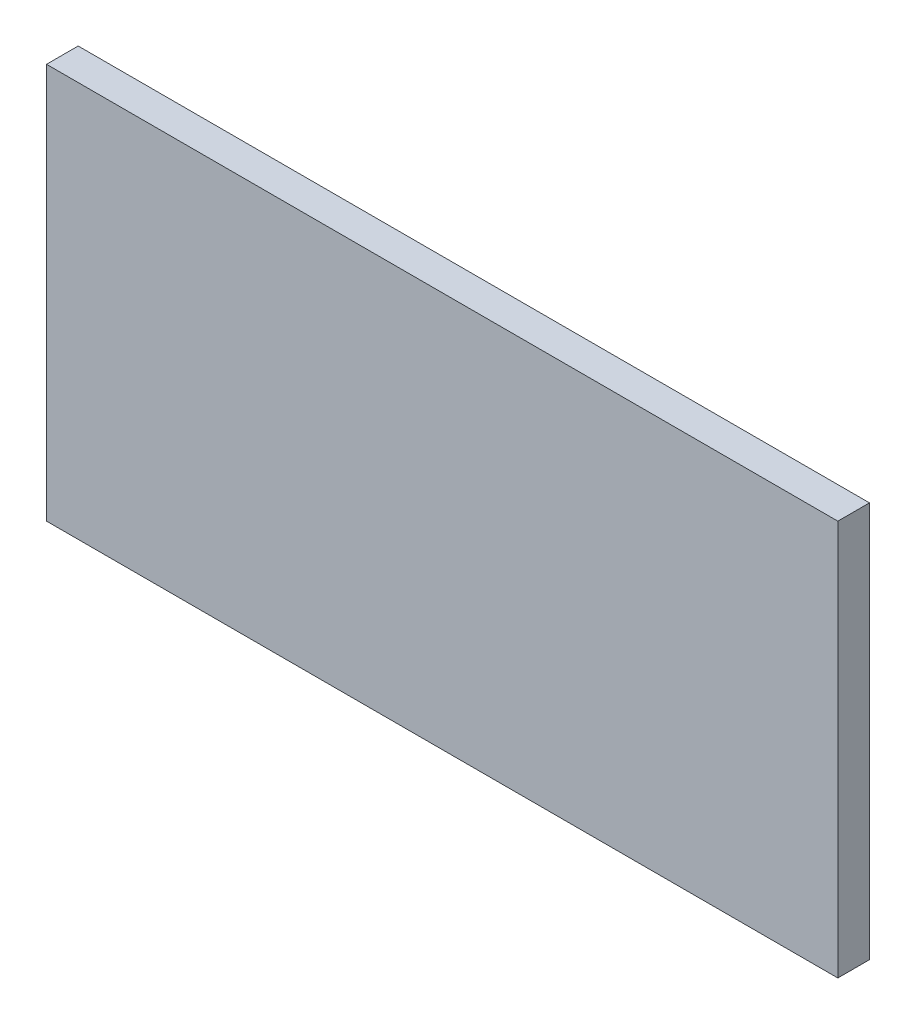
from build123d import *

# Parameters (mm, degrees)
SKETCH_1_W      = 50
SKETCH_1_H      = 25
EXTRUDE_1_DEPTH = 2


with BuildPart() as part:
    # 草图1 → 凸台-拉伸1 (new body)
    with BuildSketch(Plane.XY):
        with Locations((-30.565068493, 17.589541436)):
            Rectangle(SKETCH_1_W, SKETCH_1_H)
    extrude(amount=EXTRUDE_1_DEPTH)


solid = part.part
